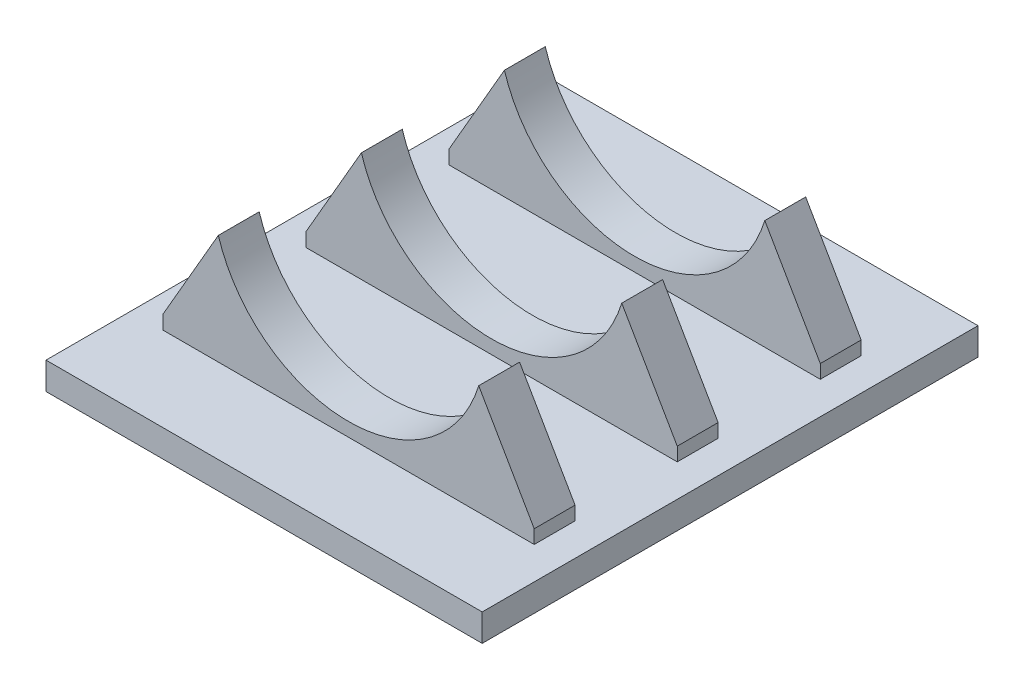
from build123d import *

# Parameters (mm, degrees)
EXTRUDE_1_DEPTH        = 15
PATTERN_LINEAR_1_COUNT = 3
PATTERN_LINEAR_1_PITCH = 52.5
SKETCH_2_W             = 160.09172752
SKETCH_2_H             = 181.978003312
EXTRUDE_2_DEPTH        = 10


with BuildPart() as part:
    # 草图1 → 凸台-拉伸1 (new body)
    with BuildSketch(Plane.XY):
        with BuildLine():
            Line((-47.784051252, 35.279794638), (-68.152850184, 0))
            Line((-68.152850184, 0), (-68.152850184, -5))
            Line((-68.152850184, -5), (68.152850184, -5))
            Line((68.152850184, -5), (68.152850184, 0))
            Line((68.152850184, 0), (47.784051252, 35.279794638))
            ThreePointArc((47.784051252, 35.279794638), (0, 0), (-47.784051252, 35.279794638))
        make_face()
    extrude(amount=EXTRUDE_1_DEPTH)


with BuildPart() as pattern_linear_1_1:
    # 阵列(线性)1: pattern copy
    add(part.part.moved(Location(Vector(0, 0, 1) * (1 * PATTERN_LINEAR_1_PITCH))))


with BuildPart() as pattern_linear_1_2:
    # 阵列(线性)1: pattern copy
    add(part.part.moved(Location(Vector(0, 0, 1) * (2 * PATTERN_LINEAR_1_PITCH))))


with BuildPart() as part_1:
    add(part.part)

    add(pattern_linear_1_1.part)  # 凸台-拉伸2 merges 阵列(线性)1_1

    add(pattern_linear_1_2.part)  # 凸台-拉伸2 merges 阵列(线性)1_2
    # 草图2 → 凸台-拉伸2 (add)
    with BuildSketch(Plane(origin=(0, -5, 0), x_dir=(-1, 0, 0), z_dir=(0, -1, 0))):
        with Locations((0, -60)):
            Rectangle(SKETCH_2_W, SKETCH_2_H)
    extrude(amount=EXTRUDE_2_DEPTH)


solid = part_1.part
